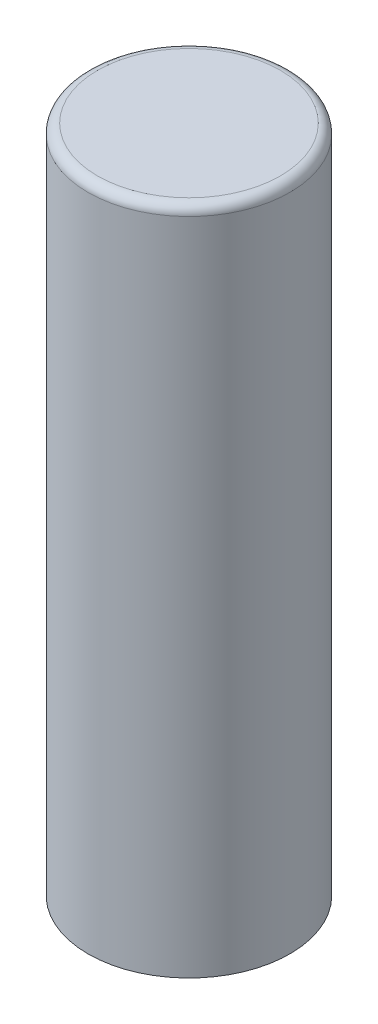
from build123d import *

# Parameters (mm, degrees)
SKETCH2_R           = 10.61
BOSS_EXTRUDE1_DEPTH = 70.3
FILLET1_R           = 1


with BuildPart() as part:
    # Sketch2 → Boss-Extrude1 (new body)
    with BuildSketch(Plane(origin=(0, 0, 0), x_dir=(1, 0, 0), z_dir=(0, 1, 0))):
        with Locations(Location((0, 0, 0), (0, 0, 270))):
            Circle(SKETCH2_R)
    extrude(amount=BOSS_EXTRUDE1_DEPTH)

    # Fillet1
    fillet1_edges = [part.edges().sort_by_distance(p)[0] for p in [
        (0, 70.3, -10.61),
    ]]
    fillet(fillet1_edges, radius=FILLET1_R)


solid = part.part
